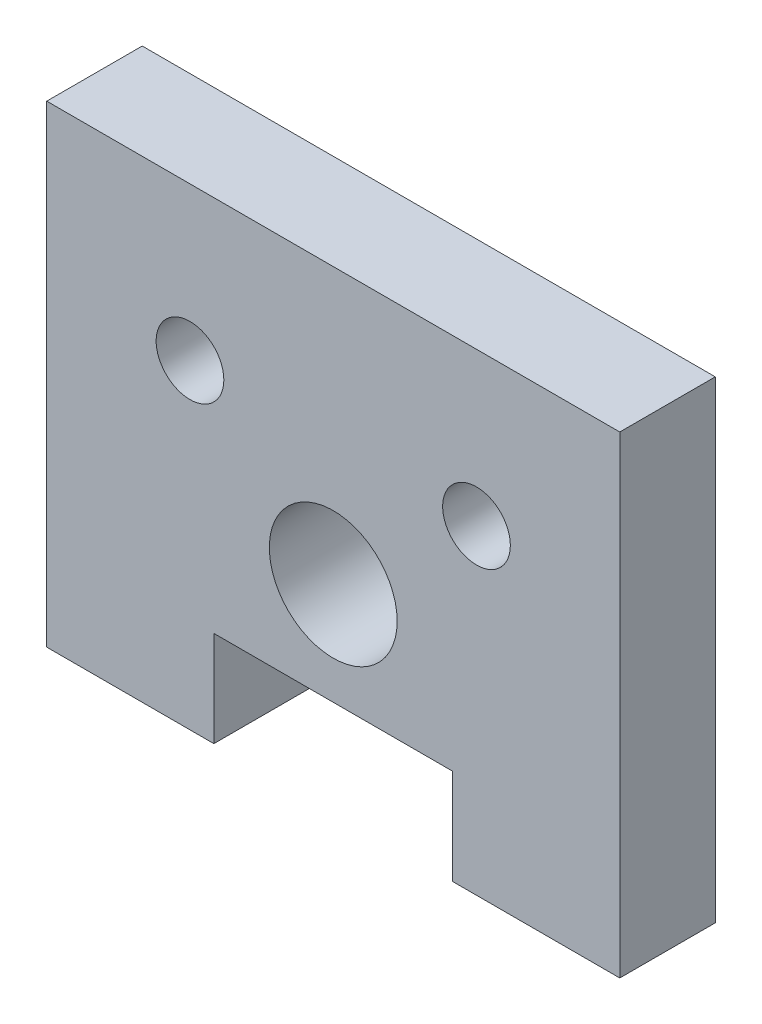
from build123d import *

# Parameters (mm, degrees)
SKETCH1_R           = 4.5
BOSS_EXTRUDE2_DEPTH = 12.7


with BuildPart() as part:
    # Sketch1 → Boss-Extrude2 (new body)
    with BuildSketch(Plane.XY):
        Polygon((-38.1, -34.544), (-15.875, -34.544), (-15.875, -21.844), (0, -21.844), (15.875, -21.844), (15.875, -34.544), (38.1, -34.544), (38.1, 28.336368082), (-19.05, 28.336368082), (-38.1, 28.336368082), align=None)
        with BuildLine():
            ThreePointArc((8.5, -8.264), (6.01040764, -14.27440764), (0, -16.764))
            ThreePointArc((0, -16.764), (-6.01040764, -2.25359236), (8.5, -8.264))
        make_face(mode=Mode.SUBTRACT)
        with Locations((-19.05, 7.992)):
            Circle(SKETCH1_R, mode=Mode.SUBTRACT)
        with Locations((19.05, 7.992)):
            Circle(SKETCH1_R, mode=Mode.SUBTRACT)
    extrude(amount=BOSS_EXTRUDE2_DEPTH)


solid = part.part
